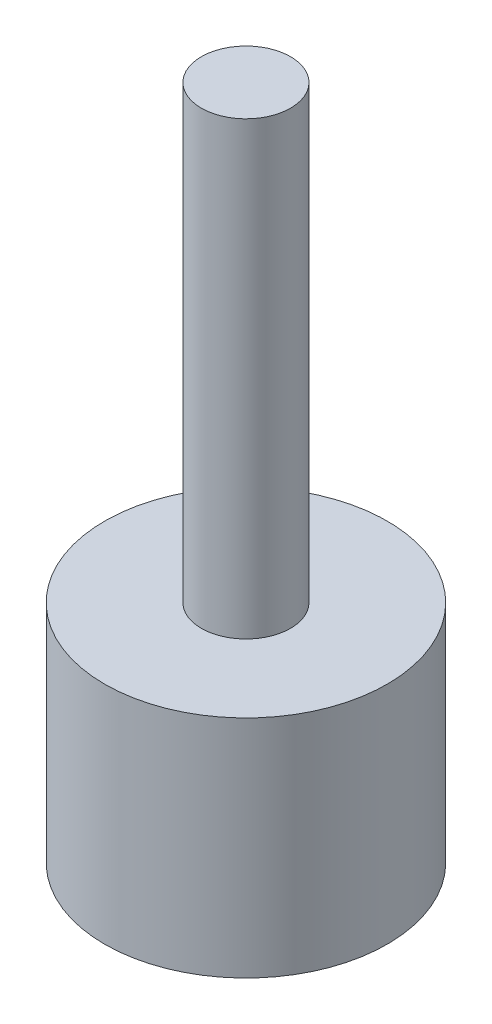
from build123d import *

# Parameters (mm, degrees)
SKETCH1_R           = 3.135927073
SKETCH1_R_2         = 2.01
BOSS_EXTRUDE1_DEPTH = 5
CUT_EXTRUDE4_DEPTH  = 4
SKETCH4_R           = 0.99
BOSS_EXTRUDE3_DEPTH = 10


with BuildPart() as part:
    # Sketch1 → Boss-Extrude1 (new body)
    # profile 1 of 4: a face of its own
    with BuildSketch(Plane(origin=(0, 0, 0), x_dir=(1, 0, 0), z_dir=(0, 1, 0))):
        with Locations(Location((0, 0, 0), (0, 0, 270))):
            Circle(SKETCH1_R)
        Circle(SKETCH1_R_2, mode=Mode.SUBTRACT)
    # profile 2 of 4: a face of its own
    with BuildSketch(Plane(origin=(0, 0, 0), x_dir=(1, 0, 0), z_dir=(0, 1, 0))):
        with BuildLine():
            Line((1.48610851, 1.353359337), (-1.48610851, 1.353359337))
            ThreePointArc((-1.48610851, 1.353359337), (-2.009995593, 0.004208893), (-1.491763272, -1.347123729))
            Line((-1.491763272, -1.347123729), (1.491763272, -1.347123729))
            ThreePointArc((1.491763272, -1.347123729), (1.875972305, -0.721684081), (2.01, 0))
            ThreePointArc((2.01, 0), (1.874457002, 0.725610741), (1.48610851, 1.353359337))
        make_face()
    # profile 3 of 4: a face of its own
    with BuildSketch(Plane(origin=(0, 0, 0), x_dir=(1, 0, 0), z_dir=(0, 1, 0))):
        with BuildLine():
            ThreePointArc((1.48610851, 1.353359337), (0, 2.01), (-1.48610851, 1.353359337))
            Line((-1.48610851, 1.353359337), (1.48610851, 1.353359337))
        make_face()
    # profile 4 of 4: a face of its own
    with BuildSketch(Plane(origin=(0, 0, 0), x_dir=(1, 0, 0), z_dir=(0, 1, 0))):
        with BuildLine():
            Line((1.491763272, -1.347123729), (-1.491763272, -1.347123729))
            ThreePointArc((-1.491763272, -1.347123729), (0, -2.01), (1.491763272, -1.347123729))
        make_face()
    extrude(amount=BOSS_EXTRUDE1_DEPTH)

    # Sketch2 → Cut-Extrude4 (cut)
    with BuildSketch(Plane(origin=(0, 0, 0), x_dir=(1, 0, 0), z_dir=(0, 1, 0))):
        with BuildLine():
            Line((-1.995763722, -1.58727035), (1.995763722, -1.58727035))
            ThreePointArc((1.995763722, -1.58727035), (2.407456904, -0.840625514), (2.55, 0))
            ThreePointArc((2.55, 0), (2.407456904, 0.840625514), (1.995763722, 1.58727035))
            Line((1.995763722, 1.58727035), (-1.995763722, 1.58727035))
            ThreePointArc((-1.995763722, 1.58727035), (-2.55, 0), (-1.995763722, -1.58727035))
        make_face()
    extrude(amount=CUT_EXTRUDE4_DEPTH, mode=Mode.SUBTRACT)

    # Sketch4 → Boss-Extrude3 (add)
    with BuildSketch(Plane(origin=(0, 5, 0), x_dir=(1, 0, 0), z_dir=(0, 1, 0))):
        with Locations(Location((0, 0, 0), (0, 0, 270))):
            Circle(SKETCH4_R)
    extrude(amount=BOSS_EXTRUDE3_DEPTH)


solid = part.part
